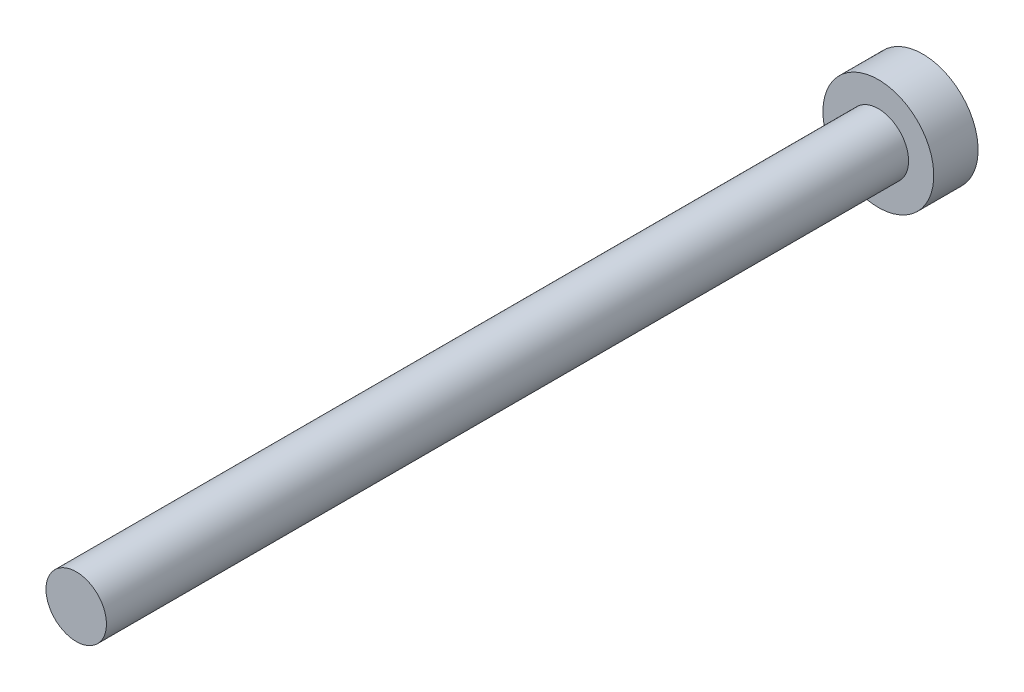
from build123d import *

# Parameters (mm, degrees)
SKETCH1_R           = 1.5
BOSS_EXTRUDE1_DEPTH = 42
SKETCH2_R           = 2.75
BOSS_EXTRUDE2_DEPTH = 2.2


with BuildPart() as part:
    # Sketch1 → Boss-Extrude1 (new body)
    with BuildSketch(Plane.XY):
        with Locations(Location((0, 0, 0), (0, 0, 180))):
            Circle(SKETCH1_R)
    extrude(amount=BOSS_EXTRUDE1_DEPTH)

    # Sketch2 → Boss-Extrude2 (add)
    with BuildSketch(Plane(origin=(0, 0, 0), x_dir=(-1, 0, 0), z_dir=(0, 0, -1))):
        Circle(SKETCH2_R)
    extrude(amount=-BOSS_EXTRUDE2_DEPTH)


solid = part.part
